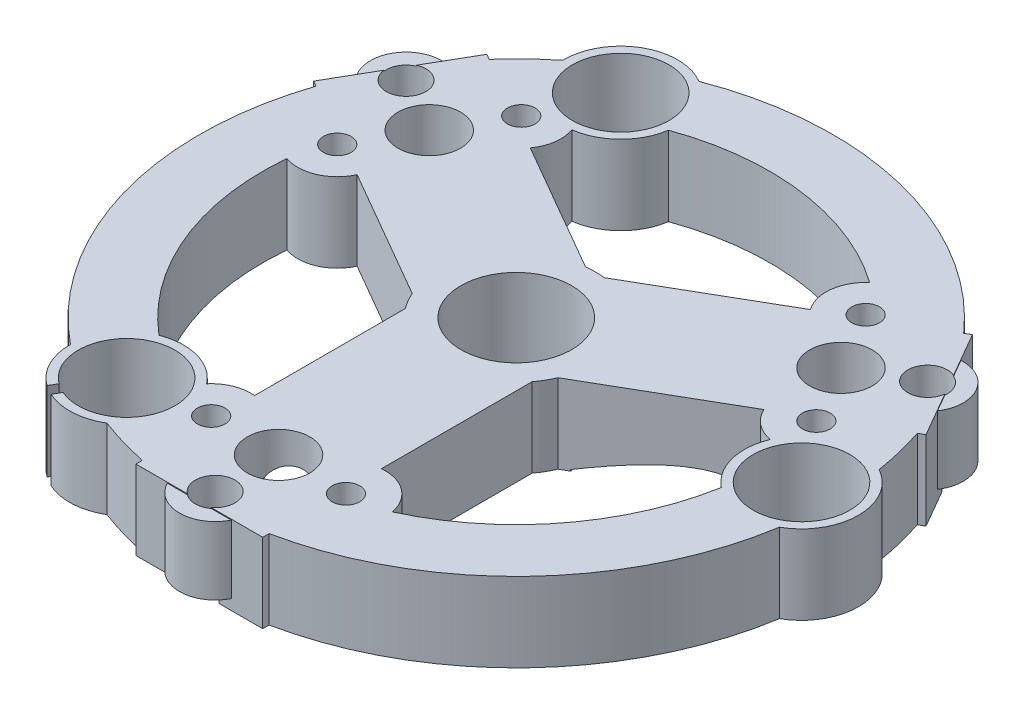
from build123d import *
from build123d.topology import SkipClean

# Parameters (mm, degrees)
MAIN_PROFILE_SKETCH_R              = 6.1
MAIN_EXTRUSION_DEPTH               = 1
DETAIL_PROFILE_2_SKETCH_R          = 6.1
DETAIL_EXTRUSION_2_DEPTH           = 0.31
DETAIL_PROFILE_3_SKETCH_R          = 2.5
DETAIL_PROFILE_3_SKETCH_R_2        = 6.1
DETAIL_EXTRUSION_3_DEPTH           = 0.4
DETAIL_PROFILE_4_SKETCH_R          = 2.5
DETAIL_PROFILE_4_SKETCH_R_2        = 3.95
DETAIL_PROFILE_4_SKETCH_R_3        = 6.1
DETAIL_EXTRUSION_4_DEPTH           = 2.99
DETAIL_PROFILE_5_SKETCH_R          = 1.1
DETAIL_PROFILE_5_SKETCH_R_2        = 2.5
DETAIL_PROFILE_5_SKETCH_R_3        = 3.95
DETAIL_PROFILE_5_SKETCH_R_4        = 6.1
DETAIL_EXTRUSION_5_DEPTH           = 1.3
DETAIL_PROFILE_6_SKETCH_R          = 1.75
DETAIL_PROFILE_6_SKETCH_R_2        = 2.5
DETAIL_PROFILE_6_SKETCH_R_3        = 3.95
DETAIL_PROFILE_6_SKETCH_R_4        = 6.1
DETAIL_EXTRUSION_6_DEPTH           = 3.89
DETAIL_PROFILE_7_SKETCH_R          = 1.75
DETAIL_PROFILE_7_SKETCH_R_2        = 3.95
DETAIL_PROFILE_7_SKETCH_R_3        = 6.1
DETAIL_EXTRUSION_7_DEPTH           = 0.11
CENTRE_INSPECTION_OPENING_SKETCH_R = 7
CENTRE_INSPECTION_OPENING_DEPTH    = 30


with BuildPart() as part:
    # Main Profile Sketch → Main Extrusion (new body)
    with BuildSketch(Plane(origin=(0, 96, 0), x_dir=(-1, 0, 0), z_dir=(0, -1, 0))):
        with BuildLine():
            Line((77.268379179, -37.732758556), (76.715284945, -36.774771242))
            ThreePointArc((76.715284945, -36.774771242), (71.241651246, -25.894159573), (77.92772051, -36.074771242))
            Line((77.92772051, -36.074771242), (78.480814744, -37.032758556))
            ThreePointArc((78.480814744, -37.032758556), (80.720355784, -34.419098671), (81.490773887, -31.064517027))
            ThreePointArc((81.490773887, -31.064517027), (94.694772954, -11.189291445), (94.232776743, 12.667714712))
            Line((94.232776743, 12.667714712), (94.932667397, 13.07179677))
            Line((94.932667397, 13.07179677), (92.181666997, 17.836669235))
            ThreePointArc((92.181666997, 17.836669235), (86.429335298, 17.4), (89.683667798, 22.163330765))
            Line((89.683667798, 22.163330765), (86.932667397, 26.92820323))
            Line((86.932667397, 26.92820323), (86.232776743, 26.524121173))
            ThreePointArc((86.232776743, 26.524121173), (83.955084507, 28.891771496), (81.490773887, 31.064517027))
            ThreePointArc((81.490773887, 31.064517027), (77.891651246, 37.412297443), (70.594750827, 37.355338874))
            ThreePointArc((70.594750827, 37.355338874), (46.780301034, 38.852724707), (26.350525749, 26.524121173))
            Line((26.350525749, 26.524121173), (25.650635095, 26.92820323))
            Line((25.650635095, 26.92820323), (22.899634694, 22.163330765))
            ThreePointArc((22.899634694, 22.163330765), (26.153967194, 17.4), (20.401635495, 17.836669235))
            Line((20.401635495, 17.836669235), (17.650635095, 13.07179677))
            Line((17.650635095, 13.07179677), (18.350525749, 12.667714712))
            ThreePointArc((18.350525749, 12.667714712), (17.438926539, 9.511350212), (16.789429024, 6.290821847))
            ThreePointArc((16.789429024, 6.290821847), (13.091651246, 0), (16.789429024, -6.290821847))
            ThreePointArc((16.789429024, -6.290821847), (27.39987975, -27.663433261), (48.291651246, -39.191835885))
            Line((48.291651246, -39.191835885), (48.291651246, -40))
            Line((48.291651246, -40), (53.793652047, -40))
            ThreePointArc((53.793652047, -40), (56.291651246, -34.8), (58.789650445, -40))
            Line((58.789650445, -40), (64.291651246, -40))
            Line((64.291651246, -40), (64.291651246, -39.191835885))
            ThreePointArc((64.291651246, -39.191835885), (67.480942691, -38.403121708), (70.594750827, -37.355338874))
            ThreePointArc((70.594750827, -37.355338874), (73.885112802, -38.365428047), (77.268379179, -37.732758556))
        make_face()
        with Locations(Location((74.291651246, 31.176914536, 0), (0, 0, 90))):
            Circle(MAIN_PROFILE_SKETCH_R, mode=Mode.SUBTRACT)
        with Locations(Location((20.291651246, 0, 0), (0, 0, 90))):
            Circle(MAIN_PROFILE_SKETCH_R, mode=Mode.SUBTRACT)
        with BuildLine():
            Line((57.487803669, 9.92820323), (73.963991375, 19.440734638))
            ThreePointArc((73.963991375, 19.440734638), (73.071540189, 21.662034378), (73.313956204, 24.043604477))
            ThreePointArc((73.313956204, 24.043604477), (69.238618343, 26.047893335), (67.173727925, 30.09286306))
            ThreePointArc((67.173727925, 30.09286306), (52.019565246, 31.713550435), (37.834445484, 26.14061123))
            ThreePointArc((37.834445484, 26.14061123), (39.526930128, 22.942969172), (38.619311117, 19.440734638))
            Line((38.619311117, 19.440734638), (55.095498823, 9.92820323))
            ThreePointArc((55.095498823, 9.92820323), (56.291651246, 10), (57.487803669, 9.92820323))
        make_face(mode=Mode.SUBTRACT)
        with BuildLine():
            Line((64.291651246, -6), (64.291651246, -25.025062814))
            ThreePointArc((64.291651246, -25.025062814), (66.661578844, -25.362827286), (68.602871042, -26.763550763))
            ThreePointArc((68.602871042, -26.763550763), (72.376305041, -24.236349076), (76.911796789, -24.47058638))
            ThreePointArc((76.911796789, -24.47058638), (85.892434567, -12.157040215), (88.158687522, 2.914103458))
            ThreePointArc((88.158687522, 2.914103458), (84.543205946, 3.04718979), (81.963991375, 5.584328177))
            Line((81.963991375, 5.584328177), (65.487803669, -3.92820323))
            ThreePointArc((65.487803669, -3.92820323), (64.951905284, -5), (64.291651246, -6))
        make_face(mode=Mode.SUBTRACT)
        with BuildLine():
            Line((47.095498823, -3.92820323), (30.619311117, 5.584328177))
            ThreePointArc((30.619311117, 5.584328177), (29.141834705, 3.700792908), (26.958126492, 2.719946286))
            ThreePointArc((26.958126492, 2.719946286), (27.260030354, -1.81154426), (24.789429024, -5.62227668))
            ThreePointArc((24.789429024, -5.62227668), (30.962953925, -19.55651022), (42.881820732, -29.054714688))
            ThreePointArc((42.881820732, -29.054714688), (44.804817664, -25.990158961), (48.291651246, -25.025062814))
            Line((48.291651246, -25.025062814), (48.291651246, -6))
            ThreePointArc((48.291651246, -6), (47.631397208, -5), (47.095498823, -3.92820323))
        make_face(mode=Mode.SUBTRACT)
    extrude(amount=-MAIN_EXTRUSION_DEPTH)

    # Detail Profile 2 Sketch → Detail Extrusion 2 (add)
    with BuildSketch(Plane(origin=(0, 97, 0), x_dir=(-1, 0, 0), z_dir=(0, -1, 0))):
        with BuildLine():
            Line((77.268379179, -37.732758556), (76.715284945, -36.774771242))
            ThreePointArc((76.715284945, -36.774771242), (71.241651246, -25.894159573), (77.92772051, -36.074771242))
            Line((77.92772051, -36.074771242), (78.480814744, -37.032758556))
            ThreePointArc((78.480814744, -37.032758556), (80.720355784, -34.419098671), (81.490773887, -31.064517027))
            ThreePointArc((81.490773887, -31.064517027), (94.694772954, -11.189291445), (94.232776743, 12.667714712))
            Line((94.232776743, 12.667714712), (94.932667397, 13.07179677))
            Line((94.932667397, 13.07179677), (92.181666997, 17.836669235))
            ThreePointArc((92.181666997, 17.836669235), (86.429335298, 17.4), (89.683667798, 22.163330765))
            Line((89.683667798, 22.163330765), (86.932667397, 26.92820323))
            Line((86.932667397, 26.92820323), (86.232776743, 26.524121173))
            ThreePointArc((86.232776743, 26.524121173), (83.955084507, 28.891771496), (81.490773887, 31.064517027))
            ThreePointArc((81.490773887, 31.064517027), (77.891651246, 37.412297443), (70.594750827, 37.355338874))
            ThreePointArc((70.594750827, 37.355338874), (46.780301034, 38.852724707), (26.350525749, 26.524121173))
            Line((26.350525749, 26.524121173), (25.650635095, 26.92820323))
            Line((25.650635095, 26.92820323), (22.899634694, 22.163330765))
            ThreePointArc((22.899634694, 22.163330765), (26.153967194, 17.4), (20.401635495, 17.836669235))
            Line((20.401635495, 17.836669235), (17.650635095, 13.07179677))
            Line((17.650635095, 13.07179677), (18.350525749, 12.667714712))
            ThreePointArc((18.350525749, 12.667714712), (17.438926539, 9.511350212), (16.789429024, 6.290821847))
            ThreePointArc((16.789429024, 6.290821847), (13.091651246, 0), (16.789429024, -6.290821847))
            ThreePointArc((16.789429024, -6.290821847), (27.39987975, -27.663433261), (48.291651246, -39.191835885))
            Line((48.291651246, -39.191835885), (48.291651246, -40))
            Line((48.291651246, -40), (53.793652047, -40))
            ThreePointArc((53.793652047, -40), (56.291651246, -34.8), (58.789650445, -40))
            Line((58.789650445, -40), (64.291651246, -40))
            Line((64.291651246, -40), (64.291651246, -39.191835885))
            ThreePointArc((64.291651246, -39.191835885), (67.480942691, -38.403121708), (70.594750827, -37.355338874))
            ThreePointArc((70.594750827, -37.355338874), (73.885112802, -38.365428047), (77.268379179, -37.732758556))
        make_face()
        with Locations(Location((74.291651246, 31.176914536, 0), (0, 0, 90))):
            Circle(DETAIL_PROFILE_2_SKETCH_R, mode=Mode.SUBTRACT)
        with Locations(Location((20.291651246, 0, 0), (0, 0, 90))):
            Circle(DETAIL_PROFILE_2_SKETCH_R, mode=Mode.SUBTRACT)
        with BuildLine():
            Line((79.12241336, 17.383275058), (79.12241336, 12.616724942))
            ThreePointArc((79.12241336, 12.616724942), (86.22241336, 15), (79.12241336, 17.383275058))
        make_face(mode=Mode.SUBTRACT)
        with BuildLine():
            Line((57.487803669, 9.92820323), (73.963991375, 19.440734638))
            ThreePointArc((73.963991375, 19.440734638), (73.071540189, 21.662034378), (73.313956204, 24.043604477))
            ThreePointArc((73.313956204, 24.043604477), (69.238618343, 26.047893335), (67.173727925, 30.09286306))
            ThreePointArc((67.173727925, 30.09286306), (52.019565246, 31.713550435), (37.834445484, 26.14061123))
            ThreePointArc((37.834445484, 26.14061123), (39.526930128, 22.942969172), (38.619311117, 19.440734638))
            Line((38.619311117, 19.440734638), (55.095498823, 9.92820323))
            ThreePointArc((55.095498823, 9.92820323), (56.291651246, 10), (57.487803669, 9.92820323))
        make_face(mode=Mode.SUBTRACT)
        with BuildLine():
            Line((64.291651246, -6), (64.291651246, -25.025062814))
            ThreePointArc((64.291651246, -25.025062814), (66.661578844, -25.362827286), (68.602871042, -26.763550763))
            ThreePointArc((68.602871042, -26.763550763), (72.376305041, -24.236349076), (76.911796789, -24.47058638))
            ThreePointArc((76.911796789, -24.47058638), (85.892434567, -12.157040215), (88.158687522, 2.914103458))
            ThreePointArc((88.158687522, 2.914103458), (84.543205946, 3.04718979), (81.963991375, 5.584328177))
            Line((81.963991375, 5.584328177), (65.487803669, -3.92820323))
            ThreePointArc((65.487803669, -3.92820323), (64.951905284, -5), (64.291651246, -6))
        make_face(mode=Mode.SUBTRACT)
        with BuildLine():
            Line((59.93062799, -28.463657507), (55.802674502, -26.080382449))
            ThreePointArc((55.802674502, -26.080382449), (53.330742759, -27.385517082), (52.341651246, -30))
            ThreePointArc((52.341651246, -30), (57.075405627, -33.871463427), (59.93062799, -28.463657507))
        make_face(mode=Mode.SUBTRACT)
        with BuildLine():
            Line((29.821912388, 11.080382449), (33.949865877, 13.463657507))
            ThreePointArc((33.949865877, 13.463657507), (31.094643514, 18.871463427), (26.360889132, 15))
            ThreePointArc((26.360889132, 15), (27.349980645, 12.385517082), (29.821912388, 11.080382449))
        make_face(mode=Mode.SUBTRACT)
        with BuildLine():
            Line((47.095498823, -3.92820323), (30.619311117, 5.584328177))
            ThreePointArc((30.619311117, 5.584328177), (29.141834705, 3.700792908), (26.958126492, 2.719946286))
            ThreePointArc((26.958126492, 2.719946286), (27.260030354, -1.81154426), (24.789429024, -5.62227668))
            ThreePointArc((24.789429024, -5.62227668), (30.962953925, -19.55651022), (42.881820732, -29.054714688))
            ThreePointArc((42.881820732, -29.054714688), (44.804817664, -25.990158961), (48.291651246, -25.025062814))
            Line((48.291651246, -25.025062814), (48.291651246, -6))
            ThreePointArc((48.291651246, -6), (47.631397208, -5), (47.095498823, -3.92820323))
        make_face(mode=Mode.SUBTRACT)
    extrude(amount=-DETAIL_EXTRUSION_2_DEPTH)

    # Detail Profile 3 Sketch → Detail Extrusion 3 (add)
    with BuildSketch(Plane(origin=(0, 97.31, 0), x_dir=(-1, 0, 0), z_dir=(0, -1, 0))):
        with BuildLine():
            Line((77.268379179, -37.732758556), (76.715284945, -36.774771242))
            ThreePointArc((76.715284945, -36.774771242), (71.241651246, -25.894159573), (77.92772051, -36.074771242))
            Line((77.92772051, -36.074771242), (78.480814744, -37.032758556))
            ThreePointArc((78.480814744, -37.032758556), (80.720355784, -34.419098671), (81.490773887, -31.064517027))
            ThreePointArc((81.490773887, -31.064517027), (94.694772954, -11.189291445), (94.232776743, 12.667714712))
            Line((94.232776743, 12.667714712), (94.932667397, 13.07179677))
            Line((94.932667397, 13.07179677), (92.948231834, 16.508939989))
            ThreePointArc((92.948231834, 16.508939989), (93.097730907, 21.25), (88.91710296, 23.491060011))
            Line((88.91710296, 23.491060011), (86.932667397, 26.92820323))
            Line((86.932667397, 26.92820323), (86.232776743, 26.524121173))
            ThreePointArc((86.232776743, 26.524121173), (83.955084507, 28.891771496), (81.490773887, 31.064517027))
            ThreePointArc((81.490773887, 31.064517027), (77.891651246, 37.412297443), (70.594750827, 37.355338874))
            ThreePointArc((70.594750827, 37.355338874), (46.780301034, 38.852724707), (26.350525749, 26.524121173))
            Line((26.350525749, 26.524121173), (25.650635095, 26.92820323))
            Line((25.650635095, 26.92820323), (23.666199532, 23.491060011))
            ThreePointArc((23.666199532, 23.491060011), (19.485571585, 21.25), (19.635070658, 16.508939989))
            Line((19.635070658, 16.508939989), (17.650635095, 13.07179677))
            Line((17.650635095, 13.07179677), (18.350525749, 12.667714712))
            ThreePointArc((18.350525749, 12.667714712), (17.438926539, 9.511350212), (16.789429024, 6.290821847))
            ThreePointArc((16.789429024, 6.290821847), (13.091651246, 0), (16.789429024, -6.290821847))
            ThreePointArc((16.789429024, -6.290821847), (27.39987975, -27.663433261), (48.291651246, -39.191835885))
            Line((48.291651246, -39.191835885), (48.291651246, -40))
            Line((48.291651246, -40), (52.260522372, -40))
            ThreePointArc((52.260522372, -40), (56.291651246, -42.5), (60.32278012, -40))
            Line((60.32278012, -40), (64.291651246, -40))
            Line((64.291651246, -40), (64.291651246, -39.191835885))
            ThreePointArc((64.291651246, -39.191835885), (67.480942691, -38.403121708), (70.594750827, -37.355338874))
            ThreePointArc((70.594750827, -37.355338874), (73.885112802, -38.365428047), (77.268379179, -37.732758556))
        make_face()
        with Locations(Location((89.20061659, 19, 0), (0, 0, 90))):
            Circle(DETAIL_PROFILE_3_SKETCH_R, mode=Mode.SUBTRACT)
        with Locations(Location((74.291651246, 31.176914536, 0), (0, 0, 90))):
            Circle(DETAIL_PROFILE_3_SKETCH_R_2, mode=Mode.SUBTRACT)
        with Locations(Location((56.291651246, -38, 0), (0, 0, 90))):
            Circle(DETAIL_PROFILE_3_SKETCH_R, mode=Mode.SUBTRACT)
        with Locations(Location((23.382685902, 19, 0), (0, 0, 90))):
            Circle(DETAIL_PROFILE_3_SKETCH_R, mode=Mode.SUBTRACT)
        with Locations(Location((20.291651246, 0, 0), (0, 0, 90))):
            Circle(DETAIL_PROFILE_3_SKETCH_R_2, mode=Mode.SUBTRACT)
        with BuildLine():
            Line((79.12241336, 17.383275058), (79.12241336, 12.616724942))
            ThreePointArc((79.12241336, 12.616724942), (86.22241336, 15), (79.12241336, 17.383275058))
        make_face(mode=Mode.SUBTRACT)
        with BuildLine():
            Line((57.487803669, 9.92820323), (73.963991375, 19.440734638))
            ThreePointArc((73.963991375, 19.440734638), (73.071540189, 21.662034378), (73.313956204, 24.043604477))
            ThreePointArc((73.313956204, 24.043604477), (69.238618343, 26.047893335), (67.173727925, 30.09286306))
            ThreePointArc((67.173727925, 30.09286306), (52.019565246, 31.713550435), (37.834445484, 26.14061123))
            ThreePointArc((37.834445484, 26.14061123), (39.526930128, 22.942969172), (38.619311117, 19.440734638))
            Line((38.619311117, 19.440734638), (55.095498823, 9.92820323))
            ThreePointArc((55.095498823, 9.92820323), (56.291651246, 10), (57.487803669, 9.92820323))
        make_face(mode=Mode.SUBTRACT)
        with BuildLine():
            Line((64.291651246, -6), (64.291651246, -25.025062814))
            ThreePointArc((64.291651246, -25.025062814), (66.661578844, -25.362827286), (68.602871042, -26.763550763))
            ThreePointArc((68.602871042, -26.763550763), (72.376305041, -24.236349076), (76.911796789, -24.47058638))
            ThreePointArc((76.911796789, -24.47058638), (85.892434567, -12.157040215), (88.158687522, 2.914103458))
            ThreePointArc((88.158687522, 2.914103458), (84.543205946, 3.04718979), (81.963991375, 5.584328177))
            Line((81.963991375, 5.584328177), (65.487803669, -3.92820323))
            ThreePointArc((65.487803669, -3.92820323), (64.951905284, -5), (64.291651246, -6))
        make_face(mode=Mode.SUBTRACT)
        with BuildLine():
            Line((59.93062799, -28.463657507), (55.802674502, -26.080382449))
            ThreePointArc((55.802674502, -26.080382449), (53.330742759, -27.385517082), (52.341651246, -30))
            ThreePointArc((52.341651246, -30), (57.075405627, -33.871463427), (59.93062799, -28.463657507))
        make_face(mode=Mode.SUBTRACT)
        with BuildLine():
            Line((29.821912388, 11.080382449), (33.949865877, 13.463657507))
            ThreePointArc((33.949865877, 13.463657507), (31.094643514, 18.871463427), (26.360889132, 15))
            ThreePointArc((26.360889132, 15), (27.349980645, 12.385517082), (29.821912388, 11.080382449))
        make_face(mode=Mode.SUBTRACT)
        with BuildLine():
            Line((47.095498823, -3.92820323), (30.619311117, 5.584328177))
            ThreePointArc((30.619311117, 5.584328177), (29.141834705, 3.700792908), (26.958126492, 2.719946286))
            ThreePointArc((26.958126492, 2.719946286), (27.260030354, -1.81154426), (24.789429024, -5.62227668))
            ThreePointArc((24.789429024, -5.62227668), (30.962953925, -19.55651022), (42.881820732, -29.054714688))
            ThreePointArc((42.881820732, -29.054714688), (44.804817664, -25.990158961), (48.291651246, -25.025062814))
            Line((48.291651246, -25.025062814), (48.291651246, -6))
            ThreePointArc((48.291651246, -6), (47.631397208, -5), (47.095498823, -3.92820323))
        make_face(mode=Mode.SUBTRACT)
    extrude(amount=-DETAIL_EXTRUSION_3_DEPTH)

    # Detail Profile 4 Sketch → Detail Extrusion 4 (add)
    with BuildSketch(Plane(origin=(0, 97.71, 0), x_dir=(-1, 0, 0), z_dir=(0, -1, 0))):
        with BuildLine():
            Line((77.268379179, -37.732758556), (76.715284945, -36.774771242))
            ThreePointArc((76.715284945, -36.774771242), (71.241651246, -25.894159573), (77.92772051, -36.074771242))
            Line((77.92772051, -36.074771242), (78.480814744, -37.032758556))
            ThreePointArc((78.480814744, -37.032758556), (80.720355784, -34.419098671), (81.490773887, -31.064517027))
            ThreePointArc((81.490773887, -31.064517027), (94.694772954, -11.189291445), (94.232776743, 12.667714712))
            Line((94.232776743, 12.667714712), (94.932667397, 13.07179677))
            Line((94.932667397, 13.07179677), (92.948231834, 16.508939989))
            ThreePointArc((92.948231834, 16.508939989), (93.097730907, 21.25), (88.91710296, 23.491060011))
            Line((88.91710296, 23.491060011), (86.932667397, 26.92820323))
            Line((86.932667397, 26.92820323), (86.232776743, 26.524121173))
            ThreePointArc((86.232776743, 26.524121173), (83.955084507, 28.891771496), (81.490773887, 31.064517027))
            ThreePointArc((81.490773887, 31.064517027), (77.891651246, 37.412297443), (70.594750827, 37.355338874))
            ThreePointArc((70.594750827, 37.355338874), (46.780301034, 38.852724707), (26.350525749, 26.524121173))
            Line((26.350525749, 26.524121173), (25.650635095, 26.92820323))
            Line((25.650635095, 26.92820323), (23.666199532, 23.491060011))
            ThreePointArc((23.666199532, 23.491060011), (19.485571585, 21.25), (19.635070658, 16.508939989))
            Line((19.635070658, 16.508939989), (17.650635095, 13.07179677))
            Line((17.650635095, 13.07179677), (18.350525749, 12.667714712))
            ThreePointArc((18.350525749, 12.667714712), (17.438926539, 9.511350212), (16.789429024, 6.290821847))
            ThreePointArc((16.789429024, 6.290821847), (13.091651246, 0), (16.789429024, -6.290821847))
            ThreePointArc((16.789429024, -6.290821847), (27.39987975, -27.663433261), (48.291651246, -39.191835885))
            Line((48.291651246, -39.191835885), (48.291651246, -40))
            Line((48.291651246, -40), (52.260522372, -40))
            ThreePointArc((52.260522372, -40), (56.291651246, -42.5), (60.32278012, -40))
            Line((60.32278012, -40), (64.291651246, -40))
            Line((64.291651246, -40), (64.291651246, -39.191835885))
            ThreePointArc((64.291651246, -39.191835885), (67.480942691, -38.403121708), (70.594750827, -37.355338874))
            ThreePointArc((70.594750827, -37.355338874), (73.885112802, -38.365428047), (77.268379179, -37.732758556))
        make_face()
        with Locations(Location((89.20061659, 19, 0), (0, 0, 90))):
            Circle(DETAIL_PROFILE_4_SKETCH_R, mode=Mode.SUBTRACT)
        with Locations(Location((82.27241336, 15, 0), (0, 0, 90))):
            Circle(DETAIL_PROFILE_4_SKETCH_R_2, mode=Mode.SUBTRACT)
        with Locations(Location((74.291651246, 31.176914536, 0), (0, 0, 90))):
            Circle(DETAIL_PROFILE_4_SKETCH_R_3, mode=Mode.SUBTRACT)
        with Locations(Location((56.291651246, -30, 0), (0, 0, 90))):
            Circle(DETAIL_PROFILE_4_SKETCH_R_2, mode=Mode.SUBTRACT)
        with Locations(Location((56.291651246, -38, 0), (0, 0, 90))):
            Circle(DETAIL_PROFILE_4_SKETCH_R, mode=Mode.SUBTRACT)
        with Locations(Location((30.310889132, 15, 0), (0, 0, 90))):
            Circle(DETAIL_PROFILE_4_SKETCH_R_2, mode=Mode.SUBTRACT)
        with Locations(Location((23.382685902, 19, 0), (0, 0, 90))):
            Circle(DETAIL_PROFILE_4_SKETCH_R, mode=Mode.SUBTRACT)
        with Locations(Location((20.291651246, 0, 0), (0, 0, 90))):
            Circle(DETAIL_PROFILE_4_SKETCH_R_3, mode=Mode.SUBTRACT)
        with BuildLine():
            Line((57.487803669, 9.92820323), (73.963991375, 19.440734638))
            ThreePointArc((73.963991375, 19.440734638), (73.071540189, 21.662034378), (73.313956204, 24.043604477))
            ThreePointArc((73.313956204, 24.043604477), (69.238618343, 26.047893335), (67.173727925, 30.09286306))
            ThreePointArc((67.173727925, 30.09286306), (52.019565246, 31.713550435), (37.834445484, 26.14061123))
            ThreePointArc((37.834445484, 26.14061123), (39.526930128, 22.942969172), (38.619311117, 19.440734638))
            Line((38.619311117, 19.440734638), (55.095498823, 9.92820323))
            ThreePointArc((55.095498823, 9.92820323), (56.291651246, 10), (57.487803669, 9.92820323))
        make_face(mode=Mode.SUBTRACT)
        with BuildLine():
            Line((64.291651246, -6), (64.291651246, -25.025062814))
            ThreePointArc((64.291651246, -25.025062814), (66.661578844, -25.362827286), (68.602871042, -26.763550763))
            ThreePointArc((68.602871042, -26.763550763), (72.376305041, -24.236349076), (76.911796789, -24.47058638))
            ThreePointArc((76.911796789, -24.47058638), (85.892434567, -12.157040215), (88.158687522, 2.914103458))
            ThreePointArc((88.158687522, 2.914103458), (84.543205946, 3.04718979), (81.963991375, 5.584328177))
            Line((81.963991375, 5.584328177), (65.487803669, -3.92820323))
            ThreePointArc((65.487803669, -3.92820323), (64.951905284, -5), (64.291651246, -6))
        make_face(mode=Mode.SUBTRACT)
        with BuildLine():
            Line((47.095498823, -3.92820323), (30.619311117, 5.584328177))
            ThreePointArc((30.619311117, 5.584328177), (29.141834705, 3.700792908), (26.958126492, 2.719946286))
            ThreePointArc((26.958126492, 2.719946286), (27.260030354, -1.81154426), (24.789429024, -5.62227668))
            ThreePointArc((24.789429024, -5.62227668), (30.962953925, -19.55651022), (42.881820732, -29.054714688))
            ThreePointArc((42.881820732, -29.054714688), (44.804817664, -25.990158961), (48.291651246, -25.025062814))
            Line((48.291651246, -25.025062814), (48.291651246, -6))
            ThreePointArc((48.291651246, -6), (47.631397208, -5), (47.095498823, -3.92820323))
        make_face(mode=Mode.SUBTRACT)
    extrude(amount=-DETAIL_EXTRUSION_4_DEPTH)

    # Detail Profile 5 Sketch → Detail Extrusion 5 (add)
    with BuildSketch(Plane(origin=(0, 100.7, 0), x_dir=(-1, 0, 0), z_dir=(0, -1, 0))):
        with BuildLine():
            Line((77.268379179, -37.732758556), (76.715284945, -36.774771242))
            ThreePointArc((76.715284945, -36.774771242), (71.241651246, -25.894159573), (77.92772051, -36.074771242))
            Line((77.92772051, -36.074771242), (78.480814744, -37.032758556))
            ThreePointArc((78.480814744, -37.032758556), (80.720355784, -34.419098671), (81.490773887, -31.064517027))
            ThreePointArc((81.490773887, -31.064517027), (94.694772954, -11.189291445), (94.232776743, 12.667714712))
            Line((94.232776743, 12.667714712), (94.932667397, 13.07179677))
            Line((94.932667397, 13.07179677), (92.948231834, 16.508939989))
            ThreePointArc((92.948231834, 16.508939989), (93.097730907, 21.25), (88.91710296, 23.491060011))
            Line((88.91710296, 23.491060011), (86.932667397, 26.92820323))
            Line((86.932667397, 26.92820323), (86.232776743, 26.524121173))
            ThreePointArc((86.232776743, 26.524121173), (83.955084507, 28.891771496), (81.490773887, 31.064517027))
            ThreePointArc((81.490773887, 31.064517027), (77.891651246, 37.412297443), (70.594750827, 37.355338874))
            ThreePointArc((70.594750827, 37.355338874), (46.780301034, 38.852724707), (26.350525749, 26.524121173))
            Line((26.350525749, 26.524121173), (25.650635095, 26.92820323))
            Line((25.650635095, 26.92820323), (23.666199532, 23.491060011))
            ThreePointArc((23.666199532, 23.491060011), (19.485571585, 21.25), (19.635070658, 16.508939989))
            Line((19.635070658, 16.508939989), (17.650635095, 13.07179677))
            Line((17.650635095, 13.07179677), (18.350525749, 12.667714712))
            ThreePointArc((18.350525749, 12.667714712), (17.438926539, 9.511350212), (16.789429024, 6.290821847))
            ThreePointArc((16.789429024, 6.290821847), (13.091651246, 0), (16.789429024, -6.290821847))
            ThreePointArc((16.789429024, -6.290821847), (27.39987975, -27.663433261), (48.291651246, -39.191835885))
            Line((48.291651246, -39.191835885), (48.291651246, -40))
            Line((48.291651246, -40), (52.260522372, -40))
            ThreePointArc((52.260522372, -40), (56.291651246, -42.5), (60.32278012, -40))
            Line((60.32278012, -40), (64.291651246, -40))
            Line((64.291651246, -40), (64.291651246, -39.191835885))
            ThreePointArc((64.291651246, -39.191835885), (67.480942691, -38.403121708), (70.594750827, -37.355338874))
            ThreePointArc((70.594750827, -37.355338874), (73.885112802, -38.365428047), (77.268379179, -37.732758556))
        make_face()
        with Locations(Location((78.02241336, 22.361215932, 0), (0, 0, 90))):
            Circle(DETAIL_PROFILE_5_SKETCH_R, mode=Mode.SUBTRACT)
        with Locations(Location((89.20061659, 19, 0), (0, 0, 90))):
            Circle(DETAIL_PROFILE_5_SKETCH_R_2, mode=Mode.SUBTRACT)
        with Locations(Location((86.52241336, 7.638784068, 0), (0, 0, 90))):
            Circle(DETAIL_PROFILE_5_SKETCH_R, mode=Mode.SUBTRACT)
        with Locations(Location((82.27241336, 15, 0), (0, 0, 90))):
            Circle(DETAIL_PROFILE_5_SKETCH_R_3, mode=Mode.SUBTRACT)
        with Locations(Location((74.291651246, 31.176914536, 0), (0, 0, 90))):
            Circle(DETAIL_PROFILE_5_SKETCH_R_4, mode=Mode.SUBTRACT)
        with Locations(Location((64.791651246, -30, 0), (0, 0, 90))):
            Circle(DETAIL_PROFILE_5_SKETCH_R, mode=Mode.SUBTRACT)
        with Locations(Location((56.291651246, -30, 0), (0, 0, 90))):
            Circle(DETAIL_PROFILE_5_SKETCH_R_3, mode=Mode.SUBTRACT)
        with Locations(Location((56.291651246, -38, 0), (0, 0, 90))):
            Circle(DETAIL_PROFILE_5_SKETCH_R_2, mode=Mode.SUBTRACT)
        with Locations(Location((34.560889132, 22.361215932, 0), (0, 0, 90))):
            Circle(DETAIL_PROFILE_5_SKETCH_R, mode=Mode.SUBTRACT)
        with Locations(Location((30.310889132, 15, 0), (0, 0, 90))):
            Circle(DETAIL_PROFILE_5_SKETCH_R_3, mode=Mode.SUBTRACT)
        with Locations(Location((26.060889132, 7.638784068, 0), (0, 0, 90))):
            Circle(DETAIL_PROFILE_5_SKETCH_R, mode=Mode.SUBTRACT)
        with Locations(Location((23.382685902, 19, 0), (0, 0, 90))):
            Circle(DETAIL_PROFILE_5_SKETCH_R_2, mode=Mode.SUBTRACT)
        with Locations(Location((20.291651246, 0, 0), (0, 0, 90))):
            Circle(DETAIL_PROFILE_5_SKETCH_R_4, mode=Mode.SUBTRACT)
        with Locations(Location((47.791651246, -30, 0), (0, 0, 90))):
            Circle(DETAIL_PROFILE_5_SKETCH_R, mode=Mode.SUBTRACT)
        with BuildLine():
            Line((57.487803669, 9.92820323), (73.963991375, 19.440734638))
            ThreePointArc((73.963991375, 19.440734638), (73.071540189, 21.662034378), (73.313956204, 24.043604477))
            ThreePointArc((73.313956204, 24.043604477), (69.238618343, 26.047893335), (67.173727925, 30.09286306))
            ThreePointArc((67.173727925, 30.09286306), (52.019565246, 31.713550435), (37.834445484, 26.14061123))
            ThreePointArc((37.834445484, 26.14061123), (39.526930128, 22.942969172), (38.619311117, 19.440734638))
            Line((38.619311117, 19.440734638), (55.095498823, 9.92820323))
            ThreePointArc((55.095498823, 9.92820323), (56.291651246, 10), (57.487803669, 9.92820323))
        make_face(mode=Mode.SUBTRACT)
        with BuildLine():
            Line((64.291651246, -6), (64.291651246, -25.025062814))
            ThreePointArc((64.291651246, -25.025062814), (66.661578844, -25.362827286), (68.602871042, -26.763550763))
            ThreePointArc((68.602871042, -26.763550763), (72.376305041, -24.236349076), (76.911796789, -24.47058638))
            ThreePointArc((76.911796789, -24.47058638), (85.892434567, -12.157040215), (88.158687522, 2.914103458))
            ThreePointArc((88.158687522, 2.914103458), (84.543205946, 3.04718979), (81.963991375, 5.584328177))
            Line((81.963991375, 5.584328177), (65.487803669, -3.92820323))
            ThreePointArc((65.487803669, -3.92820323), (64.951905284, -5), (64.291651246, -6))
        make_face(mode=Mode.SUBTRACT)
        with BuildLine():
            Line((47.095498823, -3.92820323), (30.619311117, 5.584328177))
            ThreePointArc((30.619311117, 5.584328177), (29.141834705, 3.700792908), (26.958126492, 2.719946286))
            ThreePointArc((26.958126492, 2.719946286), (27.260030354, -1.81154426), (24.789429024, -5.62227668))
            ThreePointArc((24.789429024, -5.62227668), (30.962953925, -19.55651022), (42.881820732, -29.054714688))
            ThreePointArc((42.881820732, -29.054714688), (44.804817664, -25.990158961), (48.291651246, -25.025062814))
            Line((48.291651246, -25.025062814), (48.291651246, -6))
            ThreePointArc((48.291651246, -6), (47.631397208, -5), (47.095498823, -3.92820323))
        make_face(mode=Mode.SUBTRACT)
    extrude(amount=-DETAIL_EXTRUSION_5_DEPTH)

    # Detail Profile 6 Sketch → Detail Extrusion 6 (add)
    with BuildSketch(Plane(origin=(0, 102, 0), x_dir=(-1, 0, 0), z_dir=(0, -1, 0))):
        with BuildLine():
            Line((77.268379179, -37.732758556), (76.715284945, -36.774771242))
            ThreePointArc((76.715284945, -36.774771242), (71.241651246, -25.894159573), (77.92772051, -36.074771242))
            Line((77.92772051, -36.074771242), (78.480814744, -37.032758556))
            ThreePointArc((78.480814744, -37.032758556), (80.720355784, -34.419098671), (81.490773887, -31.064517027))
            ThreePointArc((81.490773887, -31.064517027), (94.694772954, -11.189291445), (94.232776743, 12.667714712))
            Line((94.232776743, 12.667714712), (94.932667397, 13.07179677))
            Line((94.932667397, 13.07179677), (92.948231834, 16.508939989))
            ThreePointArc((92.948231834, 16.508939989), (93.097730907, 21.25), (88.91710296, 23.491060011))
            Line((88.91710296, 23.491060011), (86.932667397, 26.92820323))
            Line((86.932667397, 26.92820323), (86.232776743, 26.524121173))
            ThreePointArc((86.232776743, 26.524121173), (83.955084507, 28.891771496), (81.490773887, 31.064517027))
            ThreePointArc((81.490773887, 31.064517027), (77.891651246, 37.412297443), (70.594750827, 37.355338874))
            ThreePointArc((70.594750827, 37.355338874), (46.780301034, 38.852724707), (26.350525749, 26.524121173))
            Line((26.350525749, 26.524121173), (25.650635095, 26.92820323))
            Line((25.650635095, 26.92820323), (23.666199532, 23.491060011))
            ThreePointArc((23.666199532, 23.491060011), (19.485571585, 21.25), (19.635070658, 16.508939989))
            Line((19.635070658, 16.508939989), (17.650635095, 13.07179677))
            Line((17.650635095, 13.07179677), (18.350525749, 12.667714712))
            ThreePointArc((18.350525749, 12.667714712), (17.438926539, 9.511350212), (16.789429024, 6.290821847))
            ThreePointArc((16.789429024, 6.290821847), (13.091651246, 0), (16.789429024, -6.290821847))
            ThreePointArc((16.789429024, -6.290821847), (27.39987975, -27.663433261), (48.291651246, -39.191835885))
            Line((48.291651246, -39.191835885), (48.291651246, -40))
            Line((48.291651246, -40), (52.260522372, -40))
            ThreePointArc((52.260522372, -40), (56.291651246, -42.5), (60.32278012, -40))
            Line((60.32278012, -40), (64.291651246, -40))
            Line((64.291651246, -40), (64.291651246, -39.191835885))
            ThreePointArc((64.291651246, -39.191835885), (67.480942691, -38.403121708), (70.594750827, -37.355338874))
            ThreePointArc((70.594750827, -37.355338874), (73.885112802, -38.365428047), (77.268379179, -37.732758556))
        make_face()
        with Locations(Location((78.02241336, 22.361215932, 0), (0, 0, 90))):
            Circle(DETAIL_PROFILE_6_SKETCH_R, mode=Mode.SUBTRACT)
        with Locations(Location((89.20061659, 19, 0), (0, 0, 90))):
            Circle(DETAIL_PROFILE_6_SKETCH_R_2, mode=Mode.SUBTRACT)
        with Locations(Location((86.52241336, 7.638784068, 0), (0, 0, 90))):
            Circle(DETAIL_PROFILE_6_SKETCH_R, mode=Mode.SUBTRACT)
        with Locations(Location((82.27241336, 15, 0), (0, 0, 90))):
            Circle(DETAIL_PROFILE_6_SKETCH_R_3, mode=Mode.SUBTRACT)
        with Locations(Location((74.291651246, 31.176914536, 0), (0, 0, 90))):
            Circle(DETAIL_PROFILE_6_SKETCH_R_4, mode=Mode.SUBTRACT)
        with Locations(Location((64.791651246, -30, 0), (0, 0, 90))):
            Circle(DETAIL_PROFILE_6_SKETCH_R, mode=Mode.SUBTRACT)
        with Locations(Location((56.291651246, -30, 0), (0, 0, 90))):
            Circle(DETAIL_PROFILE_6_SKETCH_R_3, mode=Mode.SUBTRACT)
        with Locations(Location((56.291651246, -38, 0), (0, 0, 90))):
            Circle(DETAIL_PROFILE_6_SKETCH_R_2, mode=Mode.SUBTRACT)
        with Locations(Location((34.560889132, 22.361215932, 0), (0, 0, 90))):
            Circle(DETAIL_PROFILE_6_SKETCH_R, mode=Mode.SUBTRACT)
        with Locations(Location((30.310889132, 15, 0), (0, 0, 90))):
            Circle(DETAIL_PROFILE_6_SKETCH_R_3, mode=Mode.SUBTRACT)
        with Locations(Location((26.060889132, 7.638784068, 0), (0, 0, 90))):
            Circle(DETAIL_PROFILE_6_SKETCH_R, mode=Mode.SUBTRACT)
        with Locations(Location((23.382685902, 19, 0), (0, 0, 90))):
            Circle(DETAIL_PROFILE_6_SKETCH_R_2, mode=Mode.SUBTRACT)
        with Locations(Location((20.291651246, 0, 0), (0, 0, 90))):
            Circle(DETAIL_PROFILE_6_SKETCH_R_4, mode=Mode.SUBTRACT)
        with Locations(Location((47.791651246, -30, 0), (0, 0, 90))):
            Circle(DETAIL_PROFILE_6_SKETCH_R, mode=Mode.SUBTRACT)
        with BuildLine():
            Line((57.487803669, 9.92820323), (73.963991375, 19.440734638))
            ThreePointArc((73.963991375, 19.440734638), (73.071540189, 21.662034378), (73.313956204, 24.043604477))
            ThreePointArc((73.313956204, 24.043604477), (69.238618343, 26.047893335), (67.173727925, 30.09286306))
            ThreePointArc((67.173727925, 30.09286306), (52.019565246, 31.713550435), (37.834445484, 26.14061123))
            ThreePointArc((37.834445484, 26.14061123), (39.526930128, 22.942969172), (38.619311117, 19.440734638))
            Line((38.619311117, 19.440734638), (55.095498823, 9.92820323))
            ThreePointArc((55.095498823, 9.92820323), (56.291651246, 10), (57.487803669, 9.92820323))
        make_face(mode=Mode.SUBTRACT)
        with BuildLine():
            Line((64.291651246, -6), (64.291651246, -25.025062814))
            ThreePointArc((64.291651246, -25.025062814), (66.661578844, -25.362827286), (68.602871042, -26.763550763))
            ThreePointArc((68.602871042, -26.763550763), (72.376305041, -24.236349076), (76.911796789, -24.47058638))
            ThreePointArc((76.911796789, -24.47058638), (85.892434567, -12.157040215), (88.158687522, 2.914103458))
            ThreePointArc((88.158687522, 2.914103458), (84.543205946, 3.04718979), (81.963991375, 5.584328177))
            Line((81.963991375, 5.584328177), (65.487803669, -3.92820323))
            ThreePointArc((65.487803669, -3.92820323), (64.951905284, -5), (64.291651246, -6))
        make_face(mode=Mode.SUBTRACT)
        with BuildLine():
            Line((47.095498823, -3.92820323), (30.619311117, 5.584328177))
            ThreePointArc((30.619311117, 5.584328177), (29.141834705, 3.700792908), (26.958126492, 2.719946286))
            ThreePointArc((26.958126492, 2.719946286), (27.260030354, -1.81154426), (24.789429024, -5.62227668))
            ThreePointArc((24.789429024, -5.62227668), (30.962953925, -19.55651022), (42.881820732, -29.054714688))
            ThreePointArc((42.881820732, -29.054714688), (44.804817664, -25.990158961), (48.291651246, -25.025062814))
            Line((48.291651246, -25.025062814), (48.291651246, -6))
            ThreePointArc((48.291651246, -6), (47.631397208, -5), (47.095498823, -3.92820323))
        make_face(mode=Mode.SUBTRACT)
    extrude(amount=-DETAIL_EXTRUSION_6_DEPTH)

    # Detail Profile 7 Sketch → Detail Extrusion 7 (add)
    with SkipClean():  # the faces are left unmerged after this step: merging them gives an invalid solid
        with BuildSketch(Plane(origin=(0, 105.89, 0), x_dir=(-1, 0, 0), z_dir=(0, -1, 0))):
            with BuildLine():
                Line((77.268379179, -37.732758556), (76.715284945, -36.774771242))
                ThreePointArc((76.715284945, -36.774771242), (71.241651246, -25.894159573), (77.92772051, -36.074771242))
                Line((77.92772051, -36.074771242), (78.480814744, -37.032758556))
                ThreePointArc((78.480814744, -37.032758556), (80.720355784, -34.419098671), (81.490773887, -31.064517027))
                ThreePointArc((81.490773887, -31.064517027), (94.694772954, -11.189291445), (94.232776743, 12.667714712))
                Line((94.232776743, 12.667714712), (94.932667397, 13.07179677))
                Line((94.932667397, 13.07179677), (91.682667397, 18.700961894))
                ThreePointArc((91.682667397, 18.700961894), (87.33010927, 17.341325117), (89.20061659, 21.5))
                ThreePointArc((89.20061659, 21.5), (89.701817515, 21.449244298), (90.182667397, 21.299038106))
                Line((90.182667397, 21.299038106), (86.932667397, 26.92820323))
                Line((86.932667397, 26.92820323), (86.232776743, 26.524121173))
                ThreePointArc((86.232776743, 26.524121173), (83.955084507, 28.891771496), (81.490773887, 31.064517027))
                ThreePointArc((81.490773887, 31.064517027), (77.891651246, 37.412297443), (70.594750827, 37.355338874))
                ThreePointArc((70.594750827, 37.355338874), (46.780301034, 38.852724707), (26.350525749, 26.524121173))
                Line((26.350525749, 26.524121173), (25.650635095, 26.92820323))
                Line((25.650635095, 26.92820323), (22.400635095, 21.299038106))
                ThreePointArc((22.400635095, 21.299038106), (22.881484976, 21.449244298), (23.382685902, 21.5))
                ThreePointArc((23.382685902, 21.5), (25.253193222, 17.341325117), (20.900635095, 18.700961894))
                Line((20.900635095, 18.700961894), (17.650635095, 13.07179677))
                Line((17.650635095, 13.07179677), (18.350525749, 12.667714712))
                ThreePointArc((18.350525749, 12.667714712), (17.438926539, 9.511350212), (16.789429024, 6.290821847))
                ThreePointArc((16.789429024, 6.290821847), (13.091651246, 0), (16.789429024, -6.290821847))
                ThreePointArc((16.789429024, -6.290821847), (27.39987975, -27.663433261), (48.291651246, -39.191835885))
                Line((48.291651246, -39.191835885), (48.291651246, -40))
                Line((48.291651246, -40), (54.791651246, -40))
                ThreePointArc((54.791651246, -40), (53.919943001, -37.209430585), (56.291651246, -35.5))
                ThreePointArc((56.291651246, -35.5), (58.663359491, -37.209430585), (57.791651246, -40))
                Line((57.791651246, -40), (64.291651246, -40))
                Line((64.291651246, -40), (64.291651246, -39.191835885))
                ThreePointArc((64.291651246, -39.191835885), (67.480942691, -38.403121708), (70.594750827, -37.355338874))
                ThreePointArc((70.594750827, -37.355338874), (73.885112802, -38.365428047), (77.268379179, -37.732758556))
            make_face()
            with Locations(Location((78.02241336, 22.361215932, 0), (0, 0, 90))):
                Circle(DETAIL_PROFILE_7_SKETCH_R, mode=Mode.SUBTRACT)
            with Locations(Location((86.52241336, 7.638784068, 0), (0, 0, 90))):
                Circle(DETAIL_PROFILE_7_SKETCH_R, mode=Mode.SUBTRACT)
            with Locations(Location((82.27241336, 15, 0), (0, 0, 90))):
                Circle(DETAIL_PROFILE_7_SKETCH_R_2, mode=Mode.SUBTRACT)
            with Locations(Location((74.291651246, 31.176914536, 0), (0, 0, 90))):
                Circle(DETAIL_PROFILE_7_SKETCH_R_3, mode=Mode.SUBTRACT)
            with Locations(Location((64.791651246, -30, 0), (0, 0, 90))):
                Circle(DETAIL_PROFILE_7_SKETCH_R, mode=Mode.SUBTRACT)
            with Locations(Location((56.291651246, -30, 0), (0, 0, 90))):
                Circle(DETAIL_PROFILE_7_SKETCH_R_2, mode=Mode.SUBTRACT)
            with Locations(Location((34.560889132, 22.361215932, 0), (0, 0, 90))):
                Circle(DETAIL_PROFILE_7_SKETCH_R, mode=Mode.SUBTRACT)
            with Locations(Location((30.310889132, 15, 0), (0, 0, 90))):
                Circle(DETAIL_PROFILE_7_SKETCH_R_2, mode=Mode.SUBTRACT)
            with Locations(Location((26.060889132, 7.638784068, 0), (0, 0, 90))):
                Circle(DETAIL_PROFILE_7_SKETCH_R, mode=Mode.SUBTRACT)
            with Locations(Location((47.791651246, -30, 0), (0, 0, 90))):
                Circle(DETAIL_PROFILE_7_SKETCH_R, mode=Mode.SUBTRACT)
            with Locations(Location((20.291651246, 0, 0), (0, 0, 90))):
                Circle(DETAIL_PROFILE_7_SKETCH_R_3, mode=Mode.SUBTRACT)
            with BuildLine():
                Line((57.487803669, 9.92820323), (73.963991375, 19.440734638))
                ThreePointArc((73.963991375, 19.440734638), (73.071540189, 21.662034378), (73.313956204, 24.043604477))
                ThreePointArc((73.313956204, 24.043604477), (69.238618343, 26.047893335), (67.173727925, 30.09286306))
                ThreePointArc((67.173727925, 30.09286306), (52.019565246, 31.713550435), (37.834445484, 26.14061123))
                ThreePointArc((37.834445484, 26.14061123), (39.526930128, 22.942969172), (38.619311117, 19.440734638))
                Line((38.619311117, 19.440734638), (55.095498823, 9.92820323))
                ThreePointArc((55.095498823, 9.92820323), (56.291651246, 10), (57.487803669, 9.92820323))
            make_face(mode=Mode.SUBTRACT)
            with BuildLine():
                Line((64.291651246, -6), (64.291651246, -25.025062814))
                ThreePointArc((64.291651246, -25.025062814), (66.661578844, -25.362827286), (68.602871042, -26.763550763))
                ThreePointArc((68.602871042, -26.763550763), (72.376305041, -24.236349076), (76.911796789, -24.47058638))
                ThreePointArc((76.911796789, -24.47058638), (85.892434567, -12.157040215), (88.158687522, 2.914103458))
                ThreePointArc((88.158687522, 2.914103458), (84.543205946, 3.04718979), (81.963991375, 5.584328177))
                Line((81.963991375, 5.584328177), (65.487803669, -3.92820323))
                ThreePointArc((65.487803669, -3.92820323), (64.951905284, -5), (64.291651246, -6))
            make_face(mode=Mode.SUBTRACT)
            with BuildLine():
                Line((47.095498823, -3.92820323), (30.619311117, 5.584328177))
                ThreePointArc((30.619311117, 5.584328177), (29.141834705, 3.700792908), (26.958126492, 2.719946286))
                ThreePointArc((26.958126492, 2.719946286), (27.260030354, -1.81154426), (24.789429024, -5.62227668))
                ThreePointArc((24.789429024, -5.62227668), (30.962953925, -19.55651022), (42.881820732, -29.054714688))
                ThreePointArc((42.881820732, -29.054714688), (44.804817664, -25.990158961), (48.291651246, -25.025062814))
                Line((48.291651246, -25.025062814), (48.291651246, -6))
                ThreePointArc((48.291651246, -6), (47.631397208, -5), (47.095498823, -3.92820323))
            make_face(mode=Mode.SUBTRACT)
        extrude(amount=-DETAIL_EXTRUSION_7_DEPTH)

    # Compression Articulation Throat 61 Sketc → Compression Articulation Throat 61 (revolve, cut)
    with SkipClean():  # the faces are left unmerged after this step: merging them gives an invalid solid
        with BuildSketch(Plane(origin=(21.848129609, 32.292361412, -7.122138515), x_dir=(-0.8343429620590533, 0.5383086561091639, -0.11872494439026368), z_dir=(-0.551245699903886, -0.8147619813060819, 0.17969722356136375)), mode=Mode.PRIVATE) as compression_articulation_throat_61_sk:
            Polygon((124.793457491, -7.104979762), (124.793457491, -4.804979762), (101.793457491, 1.915020238), (101.793457491, -7.104979762), align=None)
        revolve(compression_articulation_throat_61_sk.sketch.rotate(Axis((-90.61584298, 106.383086561, -16.187249444), (0.8343429620590537, -0.5383086561091633, 0.11872494439026321)), 111.859721482), axis=Axis((-90.61584298, 106.383086561, -16.187249444), (0.8343429620590537, -0.5383086561091633, 0.11872494439026321)), mode=Mode.SUBTRACT)

    # Compression Articulation Throat 68 Sketc → Compression Articulation Throat 68 (revolve, cut)
    with SkipClean():  # the faces are left unmerged after this step: merging them gives an invalid solid
        with BuildSketch(Plane(origin=(-55.559435073, 21.315405316, -26.260716517), x_dir=(-0.37694407644157146, 0.1446147852349051, 0.9148768917876727), z_dir=(-0.8541721659092646, 0.32770358269776195, -0.4037329227012915)), mode=Mode.PRIVATE) as compression_articulation_throat_68_sk:
            Polygon((12.308450042, 83.441173866), (10.724100051, 81.773890115), (22.767880189, 61.059022025), (28.981287547, 67.597673951), align=None)
        revolve(compression_articulation_throat_68_sk.sketch.rotate(Axis((-25.110986143, 106.383086561, -21.631997284), (-0.5199902989343897, -0.5383086561091633, 0.6631997284167648)), 326.424996124), axis=Axis((-25.110986143, 106.383086561, -21.631997284), (-0.5199902989343897, -0.5383086561091633, 0.6631997284167648)), mode=Mode.SUBTRACT)

    # Compression Articulation Throat 75 Sketc → Compression Articulation Throat 75 (revolve, cut)
    with SkipClean():  # the faces are left unmerged after this step: merging them gives an invalid solid
        with BuildSketch(Plane(origin=(-75.19414337, 14.119516346, 20.509419779), x_dir=(0.2544785459472912, -0.04778449262394895, 0.9658971539026421), z_dir=(-0.9493062747008634, 0.178255178692775, 0.2589260282064664)), mode=Mode.PRIVATE) as compression_articulation_throat_75_sk:
            Polygon((9.825663304, 88.876600419), (8.475389129, 90.738524062), (-14.088996194, 82.675837476), (-8.793573125, 75.373858667), align=None)
        revolve(compression_articulation_throat_75_sk.sketch.rotate(Axis((-53.148124615, 106.383086561, 37.819246728), (-0.3143526631246646, -0.5383086561091633, -0.781924672807028)), 1.622224493), axis=Axis((-53.148124615, 106.383086561, 37.819246728), (-0.3143526631246646, -0.5383086561091633, -0.781924672807028)), mode=Mode.SUBTRACT)

    # Centre Inspection Opening Sketch → Centre Inspection Opening (cut)
    with SkipClean():  # the faces are left unmerged after this step: merging them gives an invalid solid
        with BuildSketch(Plane(origin=(0, 110, 0), x_dir=(1, 0, 0), z_dir=(0, 1, 0))):
            with Locations(Location((-56.291651246, 0, 0), (0, 0, 90))):
                Circle(CENTRE_INSPECTION_OPENING_SKETCH_R)
        extrude(amount=-CENTRE_INSPECTION_OPENING_DEPTH, mode=Mode.SUBTRACT)


solid = part.part
